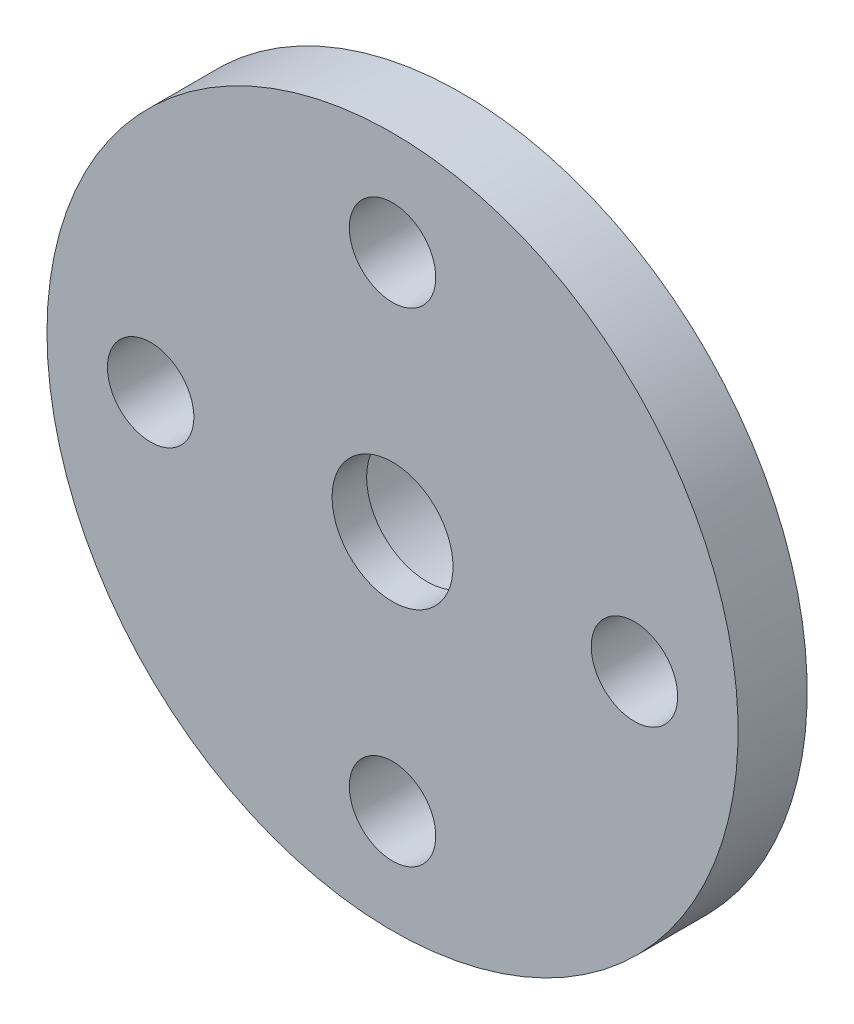
from build123d import *

# Parameters (mm, degrees)
M3X0_5_TAPPED_HOLE1_D = 2.5


with BuildPart() as part:
    # Sketch1 → Revolve1 (revolve)
    with BuildSketch(Plane(origin=(0, 0, 0), x_dir=(1, 0, 0), z_dir=(0, 1, 0))):
        Polygon((-1.75, 0), (-10, 0), (-10, 2), (-4.5, 2), (-4.5, 4.5), (-2.75, 4.5), (-2.75, 1), (-1.75, 1), align=None)
    revolve(axis=Axis((0, 0, -13.360266154), (0, 0, 1)))

    # M3x0.5 Tapped Hole1 (through all)
    with Locations(Plane(origin=(0, 0, -2), x_dir=(-1, 0, 0), z_dir=(0, 0, -1))):
        with Locations((0, 7), (7, 0), (0, -7), (-7, 0)):
            Hole(M3X0_5_TAPPED_HOLE1_D / 2)


solid = part.part
